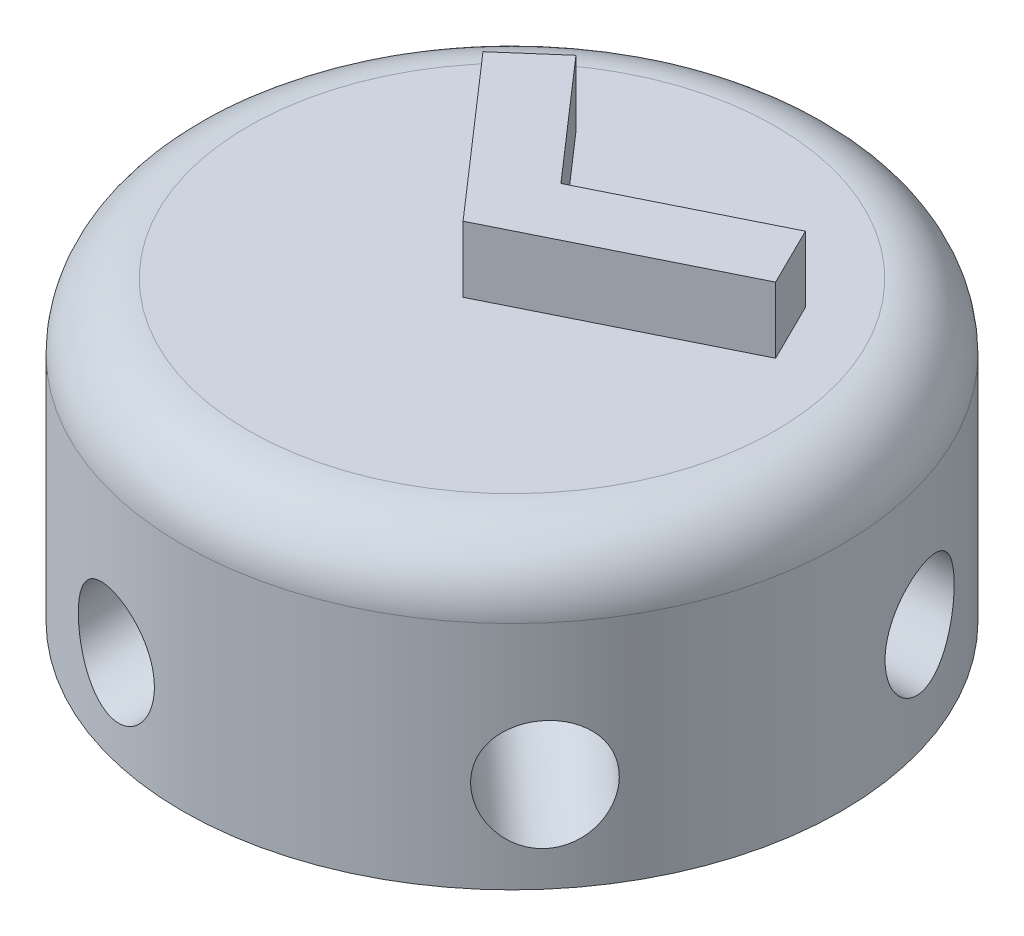
from build123d import *

# Parameters (mm, degrees)
BASE_DEPTH          = 3
BASE_DEPTH_BACK     = 6
SKETCH1_R           = 10
SKETCH3_R           = 1.6
HOLE2_DEPTH         = 19.1581212
HOLE2MIRROR_COUNT   = 2
SKETCH4_R           = 1.6
HOLE3_DEPTH         = 19.100993715
SKETCH5_R           = 1.6
CUT_EXTRUDE1_DEPTH  = 19.311666101
SKETCH6_R           = 1.6
CUT_EXTRUDE2_DEPTH  = 19.560472272
SKETCH7_R           = 1.6
CUT_EXTRUDE3_DEPTH  = 19.646604846
FILLET1_R           = 2
EXTRUDE_THIN1_DEPTH = 2


with BuildPart() as part:
    # Sketch1 → base (new, two sides: drawn at the far end of the back side and taken through both)
    with BuildSketch(Plane(origin=(0, 0, 0), x_dir=(1, 0, 0), z_dir=(0, 1, 0)).offset(-BASE_DEPTH_BACK)):
        Circle(SKETCH1_R)
    extrude(amount=BASE_DEPTH + BASE_DEPTH_BACK)

    # Sketch3 → hole2 (cut, through all)
    with BuildSketch(Plane(origin=(-0.941672921, -1.236067977, 3.685836142), x_dir=(-0.9718935871364875, 0.07382318789513377, -0.22354639834264944), z_dir=(0.23541823021467095, 0.3090169943749464, -0.921459035481267))):
        Circle(SKETCH3_R)
    hole2 = extrude(amount=-HOLE2_DEPTH, mode=Mode.SUBTRACT)

    # hole2mirror: hole2 ×2 about axis
    hole2mirror_axis = Axis((0, 5.5, 0), (0, -1, 0))
    for i in range(1, HOLE2MIRROR_COUNT):
        add(hole2.rotate(hole2mirror_axis, i * 360 / HOLE2MIRROR_COUNT), mode=Mode.SUBTRACT)

    # Sketch4 → hole3 (cut, through all)
    with BuildSketch(Plane(origin=(-3.717841, -1.236067977, 0.806098168), x_dir=(-0.19123247894507908, -0.06357892752956036, -0.979483465389136), z_dir=(0.9294602499075393, 0.30901699437494623, -0.20152454200243008))):
        Circle(SKETCH4_R)
    extrude(amount=-HOLE3_DEPTH, mode=Mode.SUBTRACT)

    # Sketch5 → Cut-Extrude1 (cut, through all)
    with BuildSketch(Plane(origin=(3.671965021, -1.093066116, -1.149730122), x_dir=(0.2754858058396647, -0.08200628219437099, 0.9578008876909271), z_dir=(-0.9179912552075574, 0.27326652891267317, 0.2874325304110031))):
        Circle(SKETCH5_R)
    extrude(amount=-CUT_EXTRUDE1_DEPTH, mode=Mode.SUBTRACT)

    # Sketch6 → Cut-Extrude2 (cut, through all)
    with BuildSketch(Plane(origin=(2.875583134, -1.236067977, 2.490613899), x_dir=(-0.5720437997755544, 0.24589274231852376, 0.782497699941298), z_dir=(-0.7188957835464718, 0.30901699437494723, -0.6226534747245682))):
        Circle(SKETCH6_R)
    extrude(amount=-CUT_EXTRUDE2_DEPTH, mode=Mode.SUBTRACT)

    # Sketch7 → Cut-Extrude3 (cut, through all)
    with BuildSketch(Plane(origin=(-2.670502563, -1.093066116, -2.770130417), x_dir=(0.7444971483747472, -0.2450509606833859, -0.6210265877802813), z_dir=(0.6676256406564008, 0.2732665289126714, 0.6925326043690294))):
        Circle(SKETCH7_R)
    extrude(amount=-CUT_EXTRUDE3_DEPTH, mode=Mode.SUBTRACT)

    # Fillet1
    fillet1_edges = [part.edges().sort_by_distance(p)[0] for p in [
        (-10, 3, 0),
    ]]
    fillet(fillet1_edges, radius=FILLET1_R)

    # Sketch9 → Extrude-Thin1 (add)
    with BuildSketch(Plane(origin=(0, 3, 0), x_dir=(1, 0, 0), z_dir=(0, 1, 0))):
        Polygon((-4.40005736, 3.518760981), (-0.246688962, -1.237871846), (6.097894842, 1.902273668), (5.210740629, 3.694746095), (0.246688962, 1.237871846), (-2.893541545, 4.834211512), align=None)
    extrude(amount=EXTRUDE_THIN1_DEPTH)


solid = part.part
